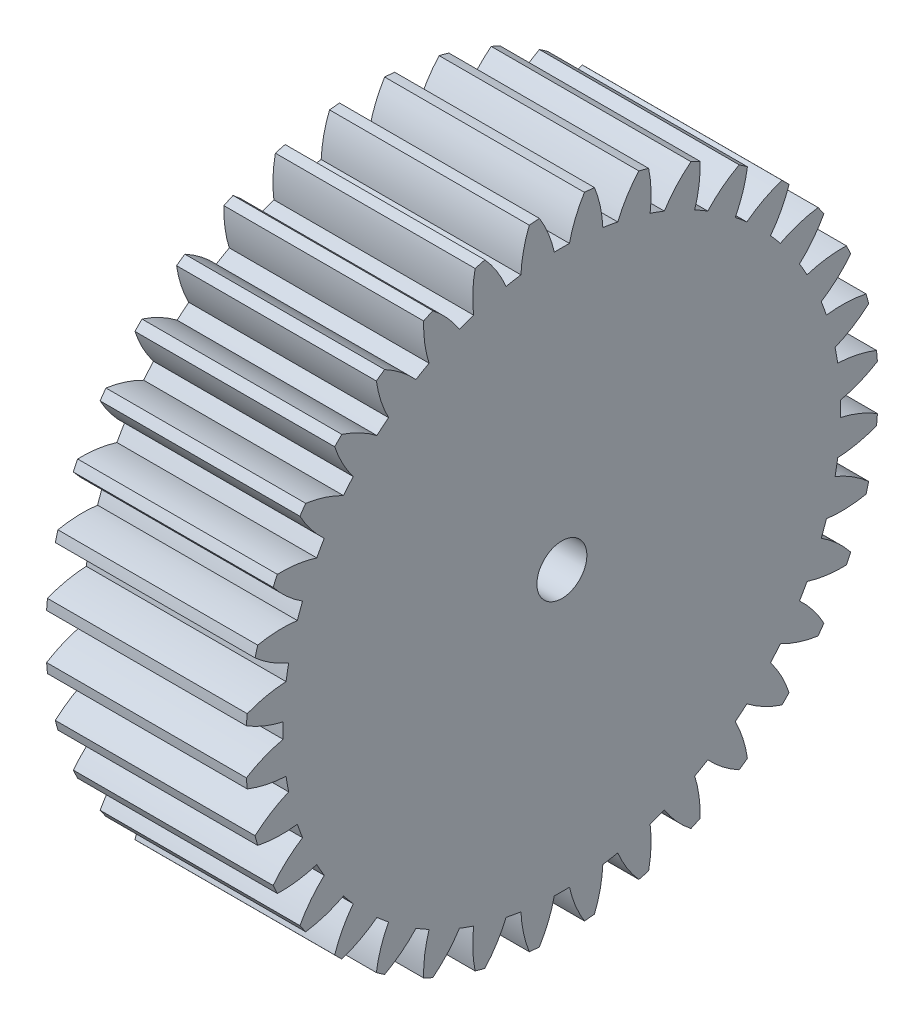
from build123d import *

# Parameters (mm, degrees)
BASPROSKE_W     = 12
BASPROSKE_H     = 19
TOOTHCUT_DEPTH  = 30.427877939
TEETHCUTS_COUNT = 36
TEETHCUTS_ANGLE = 350
BORSKE_R        = 1.5
BORE_DEPTH      = 50.0000508


with BuildPart() as part:
    # BasProSke → Base-Revolve (revolve)
    with BuildSketch(Plane(origin=(0, 0, 0), x_dir=(1, 0, 0), z_dir=(0, 1, 0)), mode=Mode.PRIVATE) as base_revolve_sk:
        with Locations((6, 9.5)):
            Rectangle(BASPROSKE_W, BASPROSKE_H)
    revolve(base_revolve_sk.sketch.rotate(Axis((-10, 0, 0), (1, 0, 0)), 180), axis=Axis((-10, 0, 0), (1, 0, 0)))

    # TooCutSke → ToothCut (cut, through all)
    with BuildSketch(Plane(origin=(0, 0, 0), x_dir=(0, 0, -1), z_dir=(1, 0, 0))):
        with BuildLine():
            ThreePointArc((0.454664826, 16.742827745), (0, 16.749), (-0.454664826, 16.742827745))
            ThreePointArc((-0.454664826, 16.742827745), (-0.817558311, 17.898033097), (-1.368909141, 18.976088452))
            ThreePointArc((-1.368909141, 18.976088452), (0, 19.0254), (1.368909141, 18.976088452))
            ThreePointArc((1.368909141, 18.976088452), (0.817558311, 17.898033097), (0.454664826, 16.742827745))
        make_face()
    toothcut = extrude(amount=TOOTHCUT_DEPTH, mode=Mode.SUBTRACT)

    # TeethCuts: ToothCut ×36 about axis
    teethcuts_axis = Axis((-10, 0, 0), (1, 0, 0))
    for i in range(1, TEETHCUTS_COUNT):
        add(toothcut.rotate(teethcuts_axis, i * TEETHCUTS_ANGLE / (TEETHCUTS_COUNT - 1)), mode=Mode.SUBTRACT)

    # BorSke → Bore (cut, symmetric)
    with BuildSketch(Plane(origin=(0, 0, 0), x_dir=(0, 0, -1), z_dir=(1, 0, 0))):
        with Locations(Location((0, 0, 0), (0, 0, 180))):
            Circle(BORSKE_R)
    extrude(amount=BORE_DEPTH, both=True, mode=Mode.SUBTRACT)


solid = part.part
